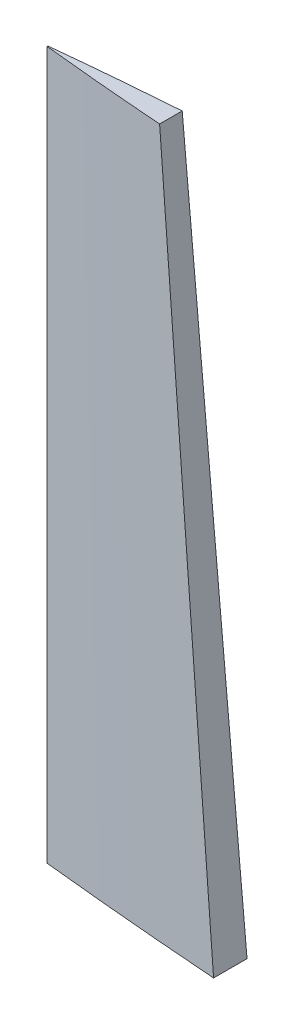
from build123d import *


with BuildPart() as part:
    # Sketch1 → Loft1 section 0
    with BuildSketch(Plane(origin=(0, 22, 0), x_dir=(1, 0, 0), z_dir=(0, 1, 0))):
        with BuildLine():
            Line((-118.316097779, 4.401506558), (-118.316097779, -4.401506558))
            add(Edge.make_bspline(
                [(-118.316097779, -4.401506558), (-118.495993978, -4.38881299), (-121.167313786, -4.200323293), (-126.18206438, -3.81196651), (-133.189099299, -3.252546709), (-139.681827725, -2.703253242), (-145.589443452, -2.181088181), (-150.847135809, -1.696926547), (-155.397319716, -1.262686024), (-159.190145274, -0.889374377), (-162.18407396, -0.587110223), (-164.346316112, -0.364458939), (-165.653207772, -0.228127654), (-166.236714621, -0.166788492), (-166.383, -0.151410742)],
                knots=[0, 0, 0, 0, 0.011211572, 0.166483201, 0.31268616, 0.448210553, 0.571562716, 0.681381362, 0.776452467, 0.855722863, 0.918312437, 0.963524724, 0.990855635, 1, 1, 1, 1], degree=3))
            Line((-166.383, -0.151410742), (-166.383, 0.151410742))
            add(Edge.make_bspline(
                [(-118.316097779, 4.401506558), (-118.495993978, 4.38881299), (-121.167313786, 4.200323293), (-126.18206438, 3.81196651), (-133.189099299, 3.252546709), (-139.681827725, 2.703253242), (-145.589443452, 2.181088181), (-150.847135809, 1.696926547), (-155.397319716, 1.262686024), (-159.190145274, 0.889374377), (-162.18407396, 0.587110223), (-164.346316112, 0.364458939), (-165.653207772, 0.228127654), (-166.236714621, 0.166788492), (-166.383, 0.151410742)],
                knots=[0, 0, 0, 0, 0.011211572, 0.166483201, 0.31268616, 0.448210553, 0.571562716, 0.681381362, 0.776452467, 0.855722863, 0.918312437, 0.963524724, 0.990855635, 1, 1, 1, 1], degree=3))
        make_face()
    # Sketch2 → Loft1 section 1
    with BuildSketch(Plane(origin=(0, 207.979, 0), x_dir=(1, 0, 0), z_dir=(0, 1, 0))):
        with BuildLine():
            Line((-133.938315, 2.970973522), (-133.938315, -2.970973522))
            add(Edge.make_bspline(
                [(-133.938315, -2.970973522), (-134.05974316, -2.962405489), (-135.862857688, -2.835176803), (-139.247764888, -2.573039804), (-143.97744436, -2.195436954), (-148.359972021, -1.824669281), (-152.347554381, -1.472213014), (-155.896444874, -1.145408685), (-158.967774141, -0.852300614), (-161.52789399, -0.600318934), (-163.548766329, -0.396293611), (-165.00825846, -0.24600619), (-165.890397443, -0.153983917), (-166.284258812, -0.112580587), (-166.383, -0.102200758)],
                knots=[0, 0, 0, 0, 0.011211572, 0.166483201, 0.31268616, 0.448210553, 0.571562716, 0.681381362, 0.776452467, 0.855722863, 0.918312437, 0.963524724, 0.990855635, 1, 1, 1, 1], degree=3))
            Line((-166.383, -0.102200758), (-166.383, 0.102200758))
            add(Edge.make_bspline(
                [(-133.938315, 2.970973522), (-134.05974316, 2.962405489), (-135.862857688, 2.835176803), (-139.247764888, 2.573039804), (-143.97744436, 2.195436954), (-148.359972021, 1.824669281), (-152.347554381, 1.472213014), (-155.896444874, 1.145408685), (-158.967774141, 0.852300614), (-161.52789399, 0.600318934), (-163.548766329, 0.396293611), (-165.00825846, 0.24600619), (-165.890397443, 0.153983917), (-166.284258812, 0.112580587), (-166.383, 0.102200758)],
                knots=[0, 0, 0, 0, 0.011211572, 0.166483201, 0.31268616, 0.448210553, 0.571562716, 0.681381362, 0.776452467, 0.855722863, 0.918312437, 0.963524724, 0.990855635, 1, 1, 1, 1], degree=3))
        make_face()
    loft()


solid = part.part
